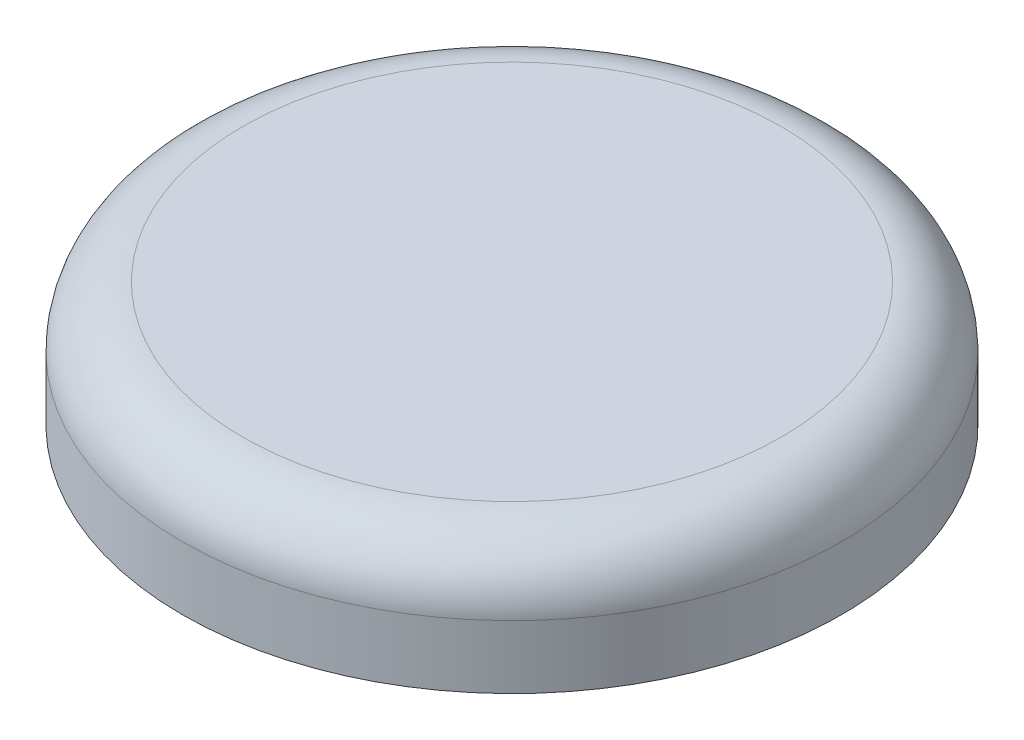
from build123d import *


with BuildPart() as part:
    # Sketch1 → Revolve1 (revolve)
    with BuildSketch(Plane.XY, mode=Mode.PRIVATE) as revolve1_sk:
        with BuildLine():
            Line((0, 0), (-62.23, 0))
            ThreePointArc((-62.23, 0), (-68.516179285, -2.603820715), (-71.12, -8.89))
            Line((-71.12, -8.89), (-71.12, -10.795))
            Line((-71.12, -10.795), (-73.66, -10.795))
            Line((-73.66, -10.795), (-73.66, -23.495))
            Line((-73.66, -23.495), (-76.2, -23.495))
            Line((-76.2, -23.495), (-76.2, -8.89))
            ThreePointArc((-76.2, -8.89), (-72.108281733, 0.988281733), (-62.23, 5.08))
            Line((-62.23, 5.08), (0, 5.08))
            Line((0, 5.08), (0, 0))
        make_face()
    revolve(revolve1_sk.sketch.rotate(Axis((0, 0, 0), (0, 1, 0)), 270), axis=Axis((0, 0, 0), (0, 1, 0)))


solid = part.part
